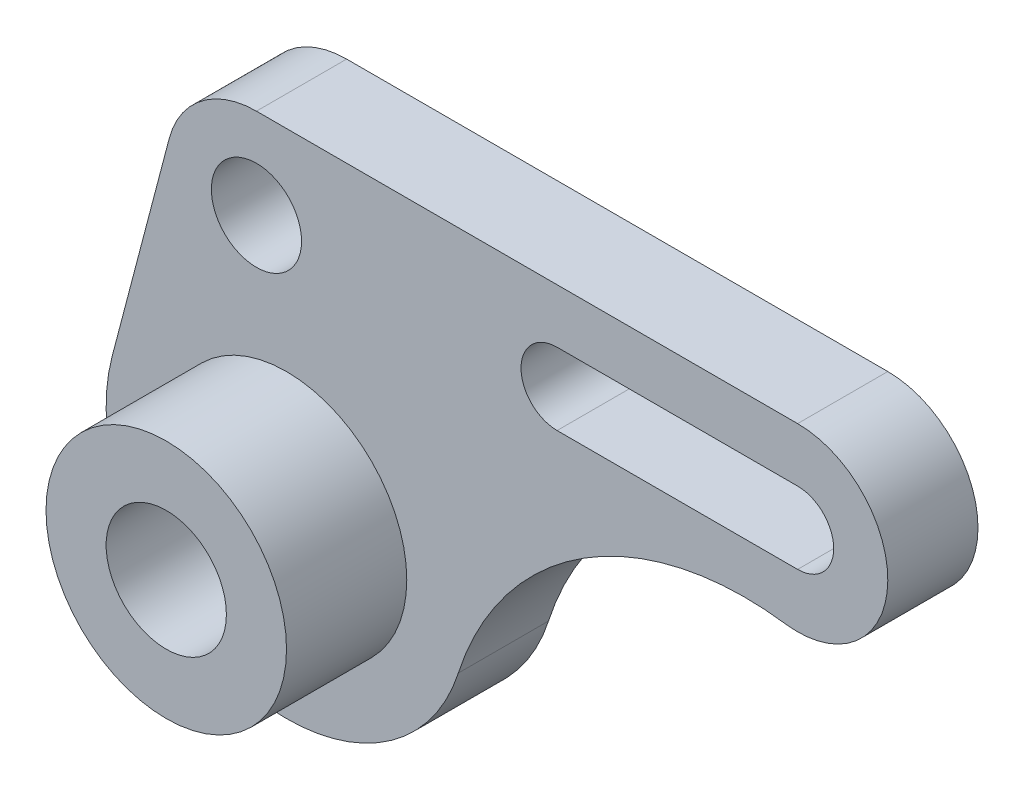
from build123d import *

# Parameters (mm, degrees)
SKETCH1_R           = 7.5
SKETCH1_R_2         = 20
BOSS_EXTRUDE3_DEPTH = 15
SKETCH1_9_R         = 20
SKETCH1_9_R_2       = 10
BOSS_EXTRUDE4_DEPTH = 35


with BuildPart() as part:
    # Sketch1 → Boss-Extrude3 (new body)
    with BuildSketch(Plane.XY):
        with BuildLine():
            Line((-11.361079264, -3.667783279), (-1.853421221, 32.520673976))
            ThreePointArc((-1.853421221, 32.520673976), (3.493809463, 40.587118039), (12.654236823, 43.709131232))
            Line((12.654236823, 43.709131232), (102.654236823, 43.709131232))
            ThreePointArc((102.654236823, 43.709131232), (117.619577951, 27.690031183), (100.620746174, 13.847606553))
            ThreePointArc((100.620746174, 13.847606553), (67.179976661, 6.607096754), (46.224814518, -20.440846371))
            ThreePointArc((46.224814518, -20.440846371), (9.264757731, -40.093935282), (-11.361079264, -3.667783279))
        make_face()
        with Locations((12.654236823, 28.709131232)):
            Circle(SKETCH1_R, mode=Mode.SUBTRACT)
        with Locations((17.654236823, -11.290868768)):
            Circle(SKETCH1_R_2, mode=Mode.SUBTRACT)
        with BuildLine():
            Line((62.654236823, 34.709131232), (102.654236823, 34.709131232))
            ThreePointArc((102.654236823, 34.709131232), (108.654236823, 28.709131232), (102.654236823, 22.709131232))
            Line((102.654236823, 22.709131232), (62.654236823, 22.709131232))
            ThreePointArc((62.654236823, 22.709131232), (56.654236823, 28.709131232), (62.654236823, 34.709131232))
        make_face(mode=Mode.SUBTRACT)
    extrude(amount=BOSS_EXTRUDE3_DEPTH)

    # Sketch1<9> → Boss-Extrude4 (add)
    with BuildSketch(Plane.XY):
        with Locations((17.654236823, -11.290868768)):
            Circle(SKETCH1_9_R)
        with Locations((17.654236823, -11.290868768)):
            Circle(SKETCH1_9_R_2, mode=Mode.SUBTRACT)
    extrude(amount=BOSS_EXTRUDE4_DEPTH)


solid = part.part
